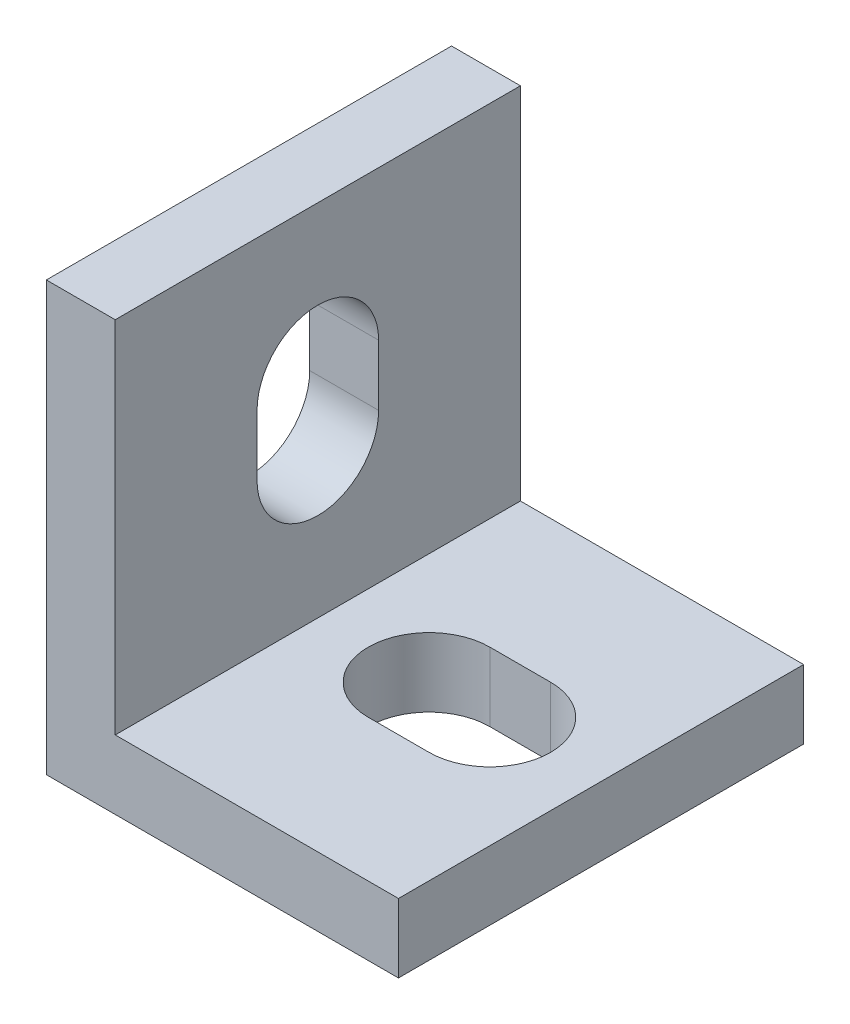
from build123d import *

# Parameters (mm, degrees)
BOSS_EXTRUDE2_DEPTH = 20
CUT_EXTRUDE1_DEPTH  = 20
CUT_EXTRUDE2_DEPTH  = 20


with BuildPart() as part:
    # Sketch1 → Boss-Extrude2 (new body)
    with BuildSketch(Plane.XY):
        Polygon((0, 0), (17.38, 0), (17.38, 3.4), (3.4, 3.4), (3.4, 21.15), (0, 21.15), align=None)
    extrude(amount=BOSS_EXTRUDE2_DEPTH)

    # Sketch2 → Cut-Extrude1 (cut)
    with BuildSketch(Plane(origin=(3.4, 0, 0), x_dir=(0, 0, -1), z_dir=(1, 0, 0))):
        with BuildLine():
            Line((-7, 13.775), (-7, 10.775))
            ThreePointArc((-7, 10.775), (-10, 7.775), (-13, 10.775))
            Line((-13, 10.775), (-13, 13.775))
            ThreePointArc((-13, 13.775), (-10, 16.775), (-7, 13.775))
        make_face()
    extrude(amount=-CUT_EXTRUDE1_DEPTH, mode=Mode.SUBTRACT)

    # Sketch3 → Cut-Extrude2 (cut)
    with BuildSketch(Plane(origin=(0, 3.4, 0), x_dir=(1, 0, 0), z_dir=(0, 1, 0))):
        with BuildLine():
            Line((8.89, -7), (11.89, -7))
            ThreePointArc((11.89, -7), (14.89, -10), (11.89, -13))
            Line((11.89, -13), (8.89, -13))
            ThreePointArc((8.89, -13), (5.89, -10), (8.89, -7))
        make_face()
    extrude(amount=-CUT_EXTRUDE2_DEPTH, mode=Mode.SUBTRACT)


solid = part.part
